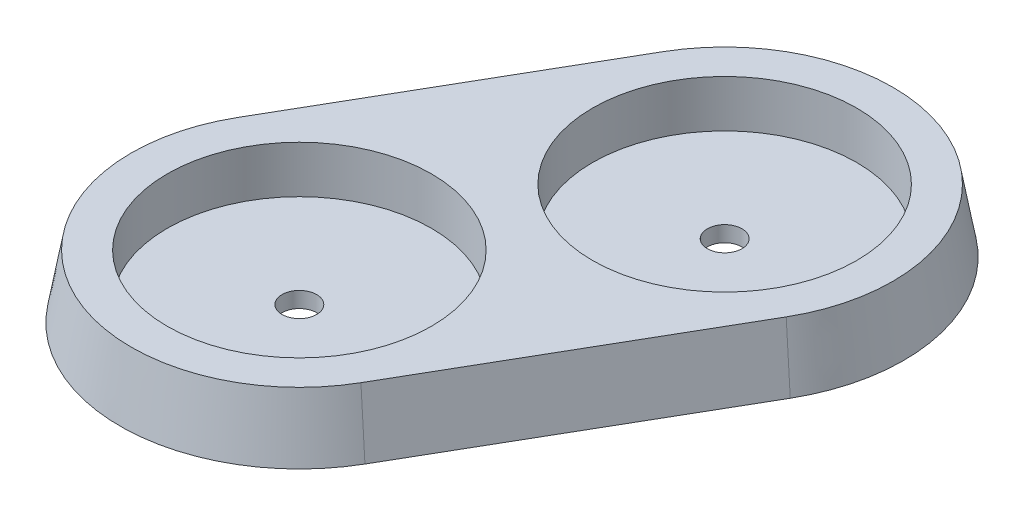
from build123d import *

# Parameters (mm, degrees)
BOSS_EXTRUDE1_DEPTH = 4
BOSS_EXTRUDE1_TAPER = 10
CUT_EXTRUDE1_START  = 4
SKETCH1_3_R         = 1.1
CUT_EXTRUDE1_DEPTH  = 4
CUT_EXTRUDE2_START  = 4
SKETCH1_4_R         = 8.4
CUT_EXTRUDE2_DEPTH  = 3


with BuildPart() as part:
    # Sketch1 → Boss-Extrude1 (new body)
    with BuildSketch(Plane(origin=(0, 0, 0), x_dir=(1, 0, 0), z_dir=(0, 1, 0))):
        with BuildLine():
            ThreePointArc((-19.772689603, -11.447302995), (-15.6, -27.019992598), (-0.027310397, -22.847302995))
            Line((-0.027310397, -22.847302995), (9.872689603, -5.7))
            ThreePointArc((9.872689603, -5.7), (5.7, 9.872689603), (-9.872689603, 5.7))
            Line((-9.872689603, 5.7), (-19.772689603, -11.447302995))
        make_face()
    extrude(amount=BOSS_EXTRUDE1_DEPTH, taper=BOSS_EXTRUDE1_TAPER)

    # Sketch1<3> → Cut-Extrude1 (cut)
    with BuildSketch(Plane(origin=(0, 0, 0), x_dir=(1, 0, 0), z_dir=(0, 1, 0)).offset(CUT_EXTRUDE1_START)):
        with Locations(Location((-9.9, -17.147302995, 0), (0, 0, 270))):
            Circle(SKETCH1_3_R)
        with Locations(Location((0, 0, 0), (0, 0, 270))):
            Circle(SKETCH1_3_R)
    extrude(amount=-CUT_EXTRUDE1_DEPTH, mode=Mode.SUBTRACT)

    # Sketch1<4> → Cut-Extrude2 (cut)
    with BuildSketch(Plane(origin=(0, 0, 0), x_dir=(1, 0, 0), z_dir=(0, 1, 0)).offset(CUT_EXTRUDE2_START)):
        with Locations(Location((0, 0, 0), (0, 0, 270))):
            Circle(SKETCH1_4_R)
        with Locations(Location((-9.9, -17.147302995, 0), (0, 0, 270))):
            Circle(SKETCH1_4_R)
    extrude(amount=-CUT_EXTRUDE2_DEPTH, mode=Mode.SUBTRACT)


solid = part.part
